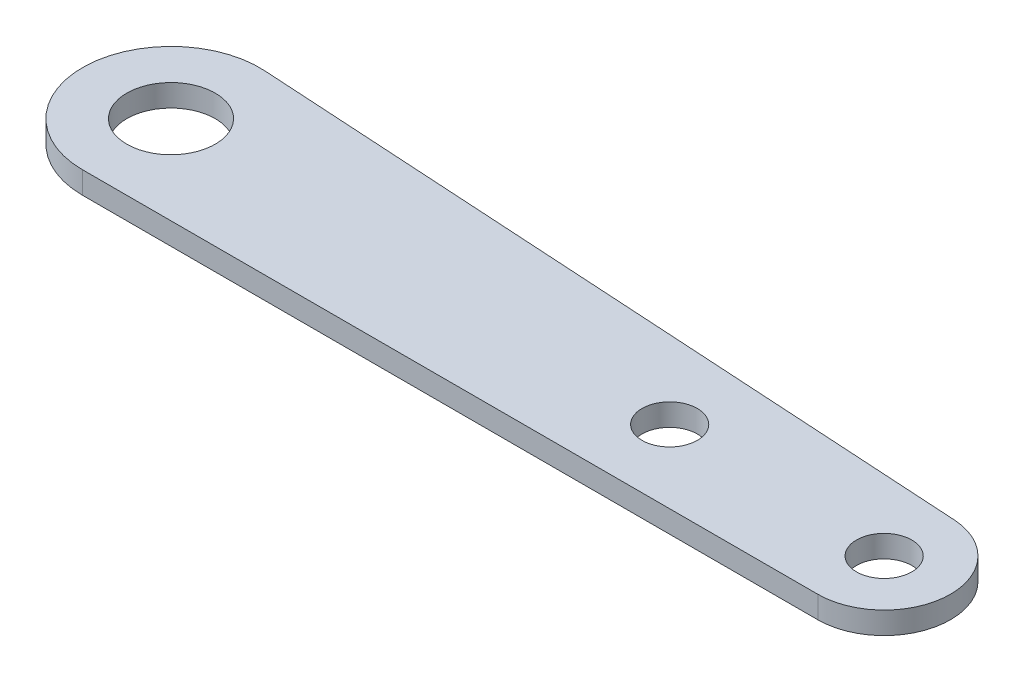
from build123d import *

# Parameters (mm, degrees)
BOSS_EXTRUDE1_DEPTH = 2
SKETCH5_R           = 4
SKETCH5_R_2         = 2.5
CUT_EXTRUDE1_DEPTH  = 2


with BuildPart() as part:
    # Sketch4 → Boss-Extrude1 (new body)
    with BuildSketch(Plane(origin=(0, 0, 0), x_dir=(1, 0, 0), z_dir=(0, 1, 0))):
        with BuildLine():
            Line((-32.38870932, 10.024010565), (33.960962355, 6.027628632))
            ThreePointArc((33.960962355, 6.027628632), (39.597509193, -0.141968292), (33.600223358, -5.961517165))
            Line((33.600223358, -5.961517165), (-32.869694651, -5.961517165))
            ThreePointArc((-32.869694651, -5.961517165), (-40.866075764, 2.279084339), (-32.38870932, 10.024010565))
        make_face()
    extrude(amount=BOSS_EXTRUDE1_DEPTH)

    # Sketch5 → Cut-Extrude1 (cut)
    with BuildSketch(Plane(origin=(0, 2, 0), x_dir=(1, 0, 0), z_dir=(0, 1, 0))):
        with Locations(Location((-32.869694651, 2.038482835, 0), (0, 0, 270))):
            Circle(SKETCH5_R)
        with Locations(Location((33.600223358, 0.038482835, 0), (0, 0, 270))):
            Circle(SKETCH5_R_2)
        with Locations(Location((13.609270573, 0.639986595, 0), (0, 0, 270))):
            Circle(SKETCH5_R_2)
    extrude(amount=-CUT_EXTRUDE1_DEPTH, mode=Mode.SUBTRACT)


solid = part.part
